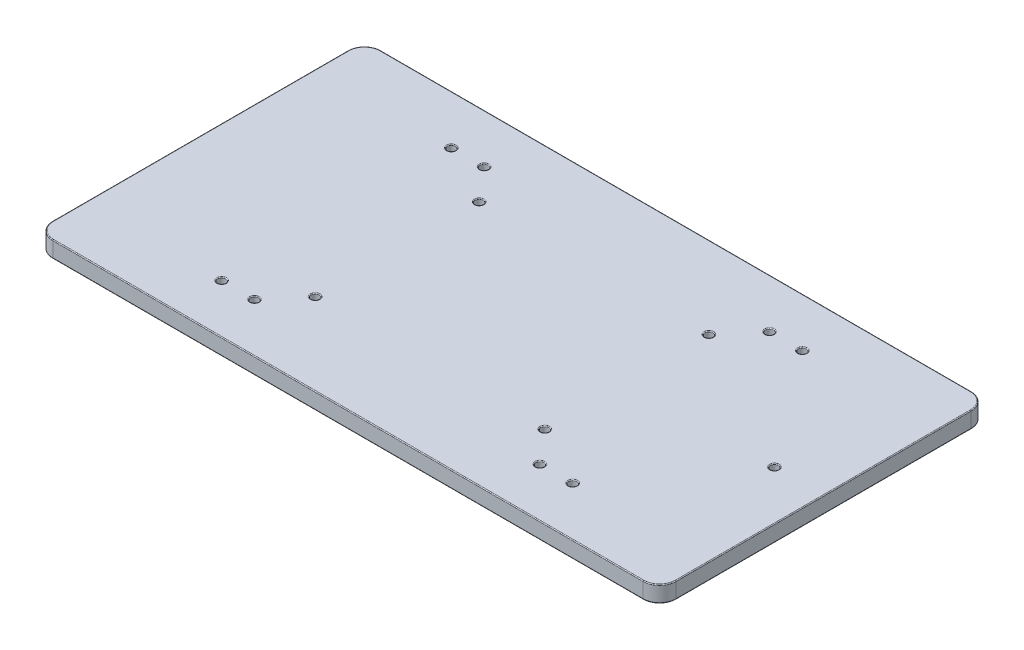
from build123d import *

# Parameters (mm, degrees)
SKETCH1_W           = 190
SKETCH1_H           = 100
SKETCH1_R           = 1.25
BOSS_EXTRUDE1_DEPTH = 5
FILLET1_R           = 5
FILLET2_R           = 0.25


with BuildPart() as part:
    # Sketch1 → Boss-Extrude1 (new body)
    with BuildSketch(Plane(origin=(0, 0, 0), x_dir=(1, 0, 0), z_dir=(0, 1, 0))):
        Rectangle(SKETCH1_W, SKETCH1_H)
        with Locations(Location((-35, 25, 0), (0, 0, 270))):
            Circle(SKETCH1_R, mode=Mode.SUBTRACT)
        with Locations(Location((35, 25, 0), (0, 0, 270))):
            Circle(SKETCH1_R, mode=Mode.SUBTRACT)
        with Locations(Location((35, -25, 0), (0, 0, 270))):
            Circle(SKETCH1_R, mode=Mode.SUBTRACT)
        with Locations(Location((-35, -25, 0), (0, 0, 270))):
            Circle(SKETCH1_R, mode=Mode.SUBTRACT)
        with Locations(Location((80, 0, 0), (0, 0, 270))):
            Circle(SKETCH1_R, mode=Mode.SUBTRACT)
        with Locations(Location((-53.5, -35, 0), (0, 0, 270))):
            Circle(SKETCH1_R, mode=Mode.SUBTRACT)
        with Locations(Location((-43.5, -35, 0), (0, 0, 270))):
            Circle(SKETCH1_R, mode=Mode.SUBTRACT)
        with Locations(Location((-53.5, 35, 0), (0, 0, 90))):
            Circle(SKETCH1_R, mode=Mode.SUBTRACT)
        with Locations(Location((-43.5, 35, 0), (0, 0, 90))):
            Circle(SKETCH1_R, mode=Mode.SUBTRACT)
        with Locations(Location((53.5, -35, 0), (0, 0, 90))):
            Circle(SKETCH1_R, mode=Mode.SUBTRACT)
        with Locations(Location((43.5, -35, 0), (0, 0, 90))):
            Circle(SKETCH1_R, mode=Mode.SUBTRACT)
        with Locations(Location((53.5, 35, 0), (0, 0, 270))):
            Circle(SKETCH1_R, mode=Mode.SUBTRACT)
        with Locations(Location((43.5, 35, 0), (0, 0, 270))):
            Circle(SKETCH1_R, mode=Mode.SUBTRACT)
    extrude(amount=BOSS_EXTRUDE1_DEPTH)

    # Fillet1
    fillet1_edges = [part.edges().sort_by_distance(p)[0] for p in [
        (95, 2.5, 50),
        (-95, 2.5, 50),
        (-95, 2.5, -50),
        (95, 2.5, -50),
    ]]
    fillet(fillet1_edges, radius=FILLET1_R)

    # Fillet2
    fillet2_edges = [part.edges().sort_by_distance(p)[0] for p in [
        (-35, 0, -26.25),
        (-35, 5, -26.25),
        (35, 0, -26.25),
        (35, 5, -26.25),
        (35, 0, 23.75),
        (35, 5, 23.75),
        (-35, 0, 23.75),
        (-35, 5, 23.75),
        (80, 0, -1.25),
        (80, 5, -1.25),
        (-53.5, 0, 33.75),
        (-53.5, 5, 33.75),
        (-43.5, 0, 33.75),
        (-43.5, 5, 33.75),
        (-53.5, 0, -33.75),
        (-53.5, 5, -33.75),
        (-43.5, 0, -33.75),
        (-43.5, 5, -33.75),
        (53.5, 0, 36.25),
        (53.5, 5, 36.25),
        (43.5, 0, 36.25),
        (43.5, 5, 36.25),
        (53.5, 0, -36.25),
        (53.5, 5, -36.25),
        (43.5, 0, -36.25),
        (43.5, 5, -36.25),
        (0, 0, 50),
        (0, 5, 50),
        (95, 0, 0),
        (-95, 0, 0),
        (0, 0, -50),
        (93.535533906, 0, 48.535533906),
        (93.535533906, 0, -48.535533906),
        (-93.535533906, 0, -48.535533906),
        (-93.535533906, 0, 48.535533906),
        (-95, 5, 0),
        (95, 5, 0),
        (0, 5, -50),
        (93.535533906, 5, 48.535533906),
        (93.535533906, 5, -48.535533906),
        (-93.535533906, 5, -48.535533906),
        (-93.535533906, 5, 48.535533906),
    ]]
    fillet(fillet2_edges, radius=FILLET2_R)


solid = part.part
